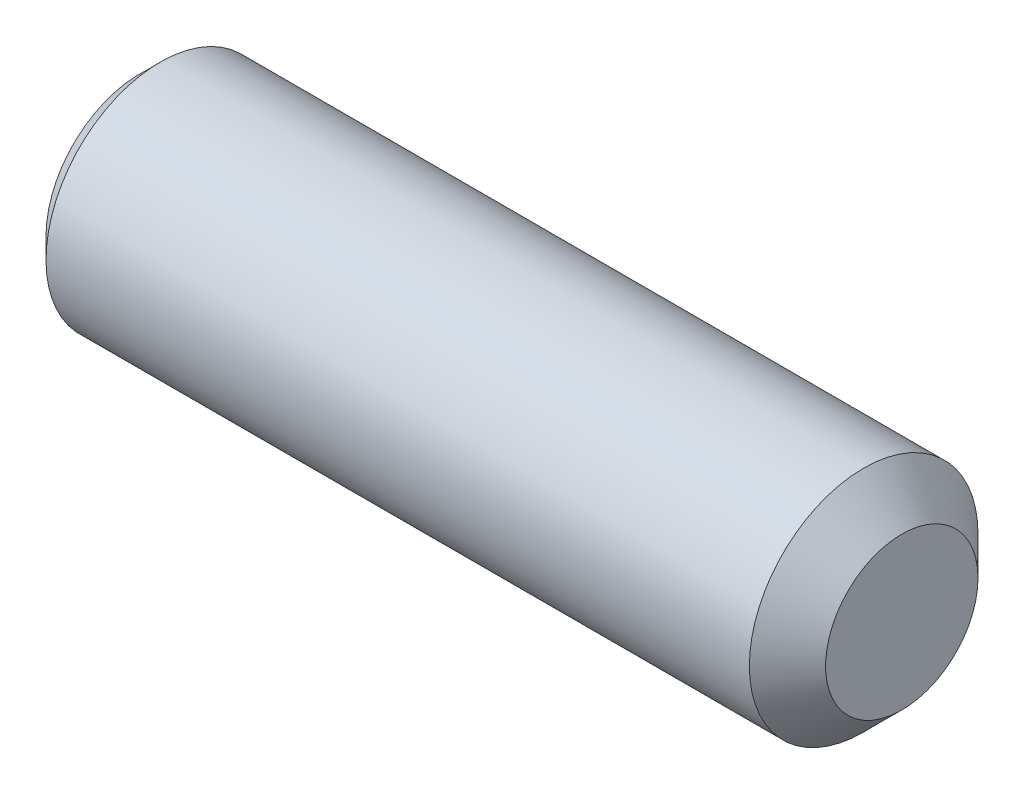
from build123d import *

# Parameters (mm, degrees)
SKETCH1_W          = 10
SKETCH1_H          = 1.5
CUT_EXTRUDE1_DEPTH = 1.2
CHAMFER1_SIZE      = 0.270625
CHAMFER2_SIZE      = 0.5


with BuildPart() as part:
    # Sketch1 → Revolve1 (revolve)
    with BuildSketch(Plane(origin=(0, 0, 0), x_dir=(-1, 0, 0), z_dir=(0, 0, -1)), mode=Mode.PRIVATE) as revolve1_sk:
        with Locations((-5, 0.75)):
            Rectangle(SKETCH1_W, SKETCH1_H)
    revolve(revolve1_sk.sketch.rotate(Axis((10, 0, 0), (-1, 0, 0)), 270), axis=Axis((10, 0, 0), (-1, 0, 0)))

    # Sketch2 → Cut-Extrude1 (cut)
    with BuildSketch(Plane.ZY):
        Polygon((-0.75, -0.433012702), (0, -0.866025404), (0.75, -0.433012702), (0.75, 0.433012702), (0, 0.866025404), (-0.75, 0.433012702), align=None)
    extrude(amount=-CUT_EXTRUDE1_DEPTH, mode=Mode.SUBTRACT)

    # Chamfer1
    chamfer1_edges = [part.edges().sort_by_distance(p)[0] for p in [
        (0, 0, -1.5),
    ]]
    chamfer(chamfer1_edges, length=CHAMFER1_SIZE)

    # Chamfer2
    chamfer2_edges = [part.edges().sort_by_distance(p)[0] for p in [
        (10, 0, -1.5),
    ]]
    chamfer(chamfer2_edges, length=CHAMFER2_SIZE)


solid = part.part
